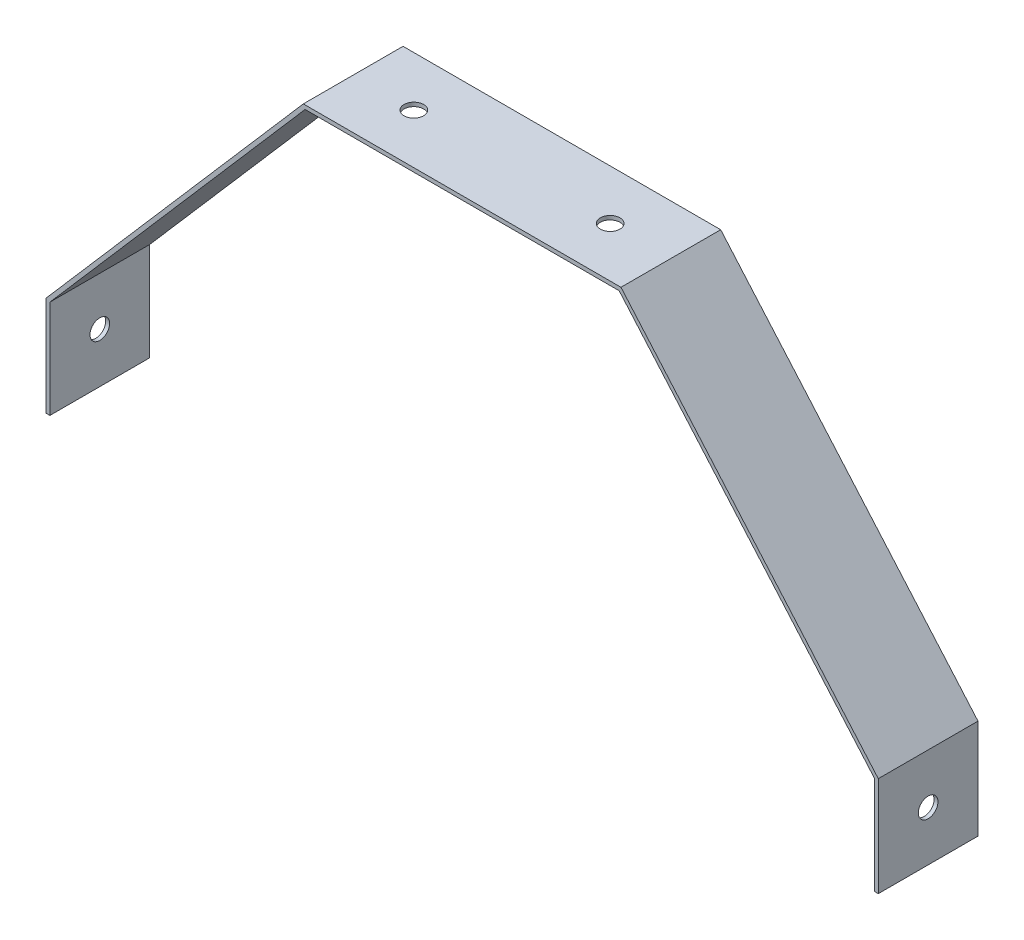
from build123d import *

# Parameters (mm, degrees)
EXTRUDE_THIN1_DEPTH     = 25.4
SKETCH3_R               = 2.5
CUT_EXTRUDE1_DEPTH      = 10
CUT_EXTRUDE2_DEPTH      = 148.922817712
CUT_EXTRUDE2_DEPTH_BACK = 148.922817712
SKETCH4_R               = 2.5


with BuildPart() as part:
    # Sketch2 → Extrude-Thin1 (new body)
    with BuildSketch(Plane.XY):
        Polygon((-105, -100), (-105, -75), (-40, 0), (40, 0), (105, -75), (105, -100), (106, -100), (106, -74.626966674), (40.456628883, 1), (-40.456628883, 1), (-106, -74.626966674), (-106, -100), align=None)
    extrude(amount=EXTRUDE_THIN1_DEPTH)

    # Sketch3 → Cut-Extrude1 (cut)
    with BuildSketch(Plane(origin=(0, 1, 0), x_dir=(1, 0, 0), z_dir=(0, 1, 0))):
        with Locations(Location((-25, -12.7, 0), (0, 0, 270))):
            Circle(SKETCH3_R)
        with Locations(Location((25, -12.7, 0), (0, 0, 270))):
            Circle(SKETCH3_R)
    extrude(amount=-CUT_EXTRUDE1_DEPTH, mode=Mode.SUBTRACT)

    # Sketch4 → Cut-Extrude2 (cut, two sides: drawn at the far end of the back side and taken through both)
    with BuildSketch(Plane(origin=(0, 0, 0), x_dir=(0, 0, -1), z_dir=(1, 0, 0)).offset(-CUT_EXTRUDE2_DEPTH_BACK)):
        with Locations((-12.7, -87.313483337)):
            Circle(SKETCH4_R)
    extrude(amount=CUT_EXTRUDE2_DEPTH + CUT_EXTRUDE2_DEPTH_BACK, mode=Mode.SUBTRACT)


solid = part.part
